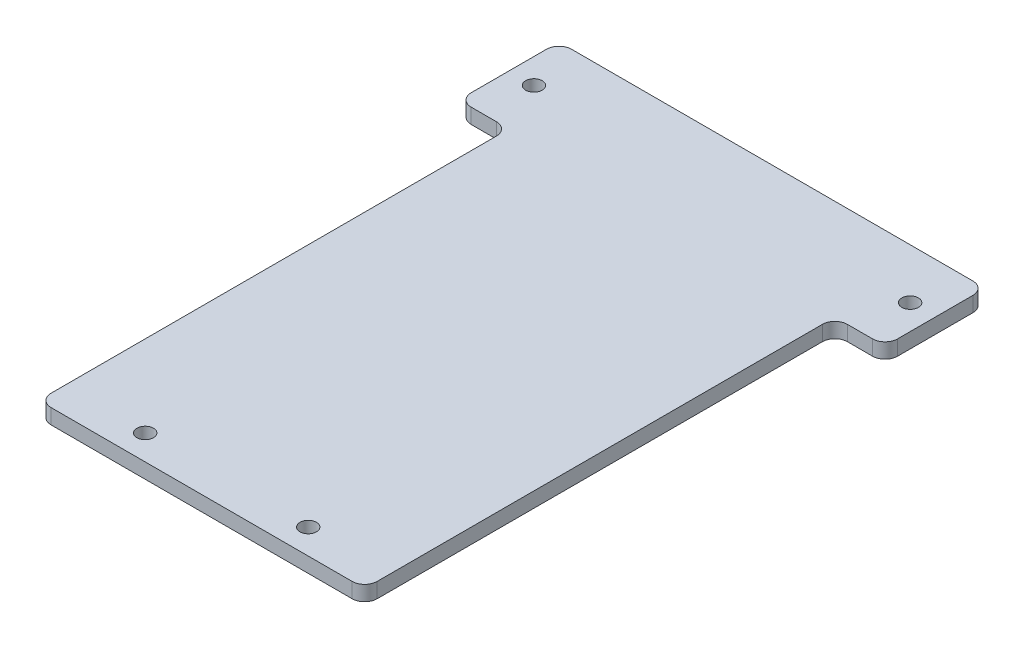
from build123d import *

# Parameters (mm, degrees)
BOSS_EXTRUDE2_DEPTH = 6
SKETCH3_R           = 3.3
CUT_EXTRUDE1_DEPTH  = 159.587712323
FILLET1_R           = 5


with BuildPart() as part:
    # Sketch1 → Boss-Extrude2 (new body)
    with BuildSketch(Plane(origin=(0, 0, 0), x_dir=(1, 0, 0), z_dir=(0, 1, 0))):
        Polygon((-85, 93.75), (-65, 93.75), (-65, -93.75), (65, -93.75), (65, 93.75), (85, 93.75), (85, 133.75), (-85, 133.75), align=None)
    extrude(amount=BOSS_EXTRUDE2_DEPTH)

    # Sketch3 → Cut-Extrude1 (cut, through all)
    with BuildSketch(Plane(origin=(0, 6, 0), x_dir=(1, 0, 0), z_dir=(0, 1, 0))):
        with Locations(Location((-75, 113.75, 0), (0, 0, 270))):
            Circle(SKETCH3_R)
        with Locations(Location((-32.5, -83.75, 0), (0, 0, 270))):
            Circle(SKETCH3_R)
        with Locations(Location((75, 113.75, 0), (0, 0, 90))):
            Circle(SKETCH3_R)
        with Locations(Location((32.5, -83.75, 0), (0, 0, 90))):
            Circle(SKETCH3_R)
    extrude(amount=-CUT_EXTRUDE1_DEPTH, mode=Mode.SUBTRACT)

    # Fillet1
    fillet1_edges = [part.edges().sort_by_distance(p)[0] for p in [
        (65, 3, -93.75),
        (65, 3, 93.75),
        (-65, 3, 93.75),
        (-65, 3, -93.75),
        (-85, 3, -93.75),
        (-85, 3, -133.75),
        (85, 3, -133.75),
        (85, 3, -93.75),
    ]]
    fillet(fillet1_edges, radius=FILLET1_R)


solid = part.part
